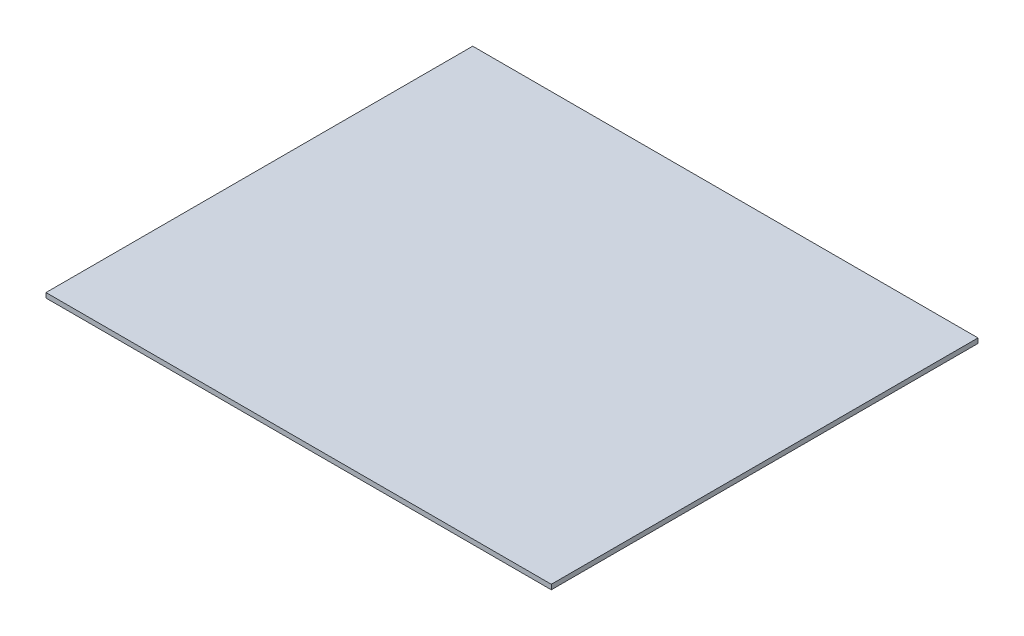
from build123d import *

# Parameters (mm, degrees)
SKETCH1_W           = 315
SKETCH1_H           = 266
BOSS_EXTRUDE1_DEPTH = 3
SKETCH2_W           = 50
SKETCH2_H           = 35
CUT_EXTRUDE1_DEPTH  = 2


with BuildPart() as part:
    # Sketch1 → Boss-Extrude1 (new body)
    with BuildSketch(Plane(origin=(0, 0, 0), x_dir=(1, 0, 0), z_dir=(0, 1, 0))):
        Rectangle(SKETCH1_W, SKETCH1_H)
    extrude(amount=BOSS_EXTRUDE1_DEPTH)

    # Sketch2 → Cut-Extrude1 (cut)
    with BuildSketch(Plane.XZ):
        with Locations((-77.25, -115.5)):
            Rectangle(SKETCH2_W, SKETCH2_H)
    cut_extrude1 = extrude(amount=-CUT_EXTRUDE1_DEPTH, mode=Mode.SUBTRACT)

    # Mirror1: Cut-Extrude1 across plane
    add(cut_extrude1.mirror(Plane(origin=(0, 0, 0), x_dir=(0, 0, 1), z_dir=(1, 0, 0))), mode=Mode.SUBTRACT)


solid = part.part
